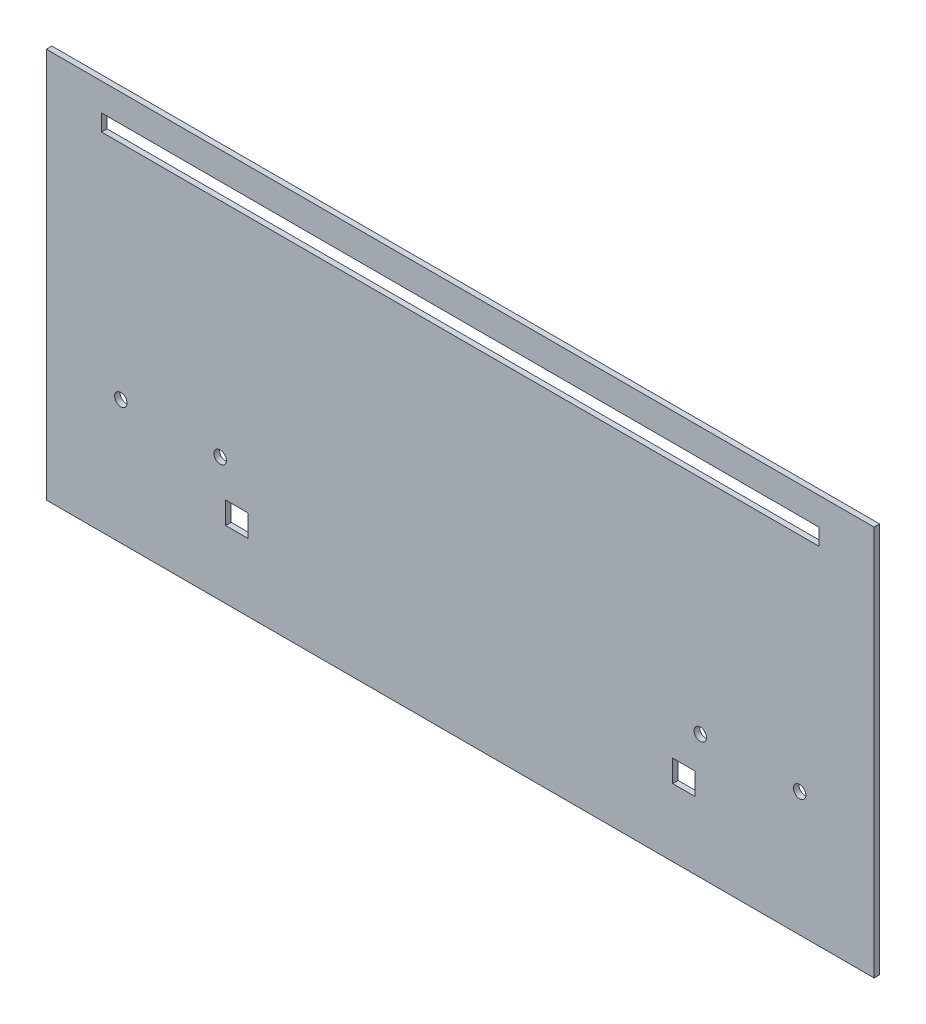
from build123d import *

# Parameters (mm, degrees)
SK_PANEL_W            = 300
SK_PANEL_H            = 141.5
EX_PANEL_DEPTH        = 2
SK_LIGHTSLOT_W        = 260
SK_LIGHTSLOT_H        = 6
CUT_LIGHTSLOT_DEPTH   = 2
SK_CLIFFBOLTS_R       = 2.25
CUT_CLIFFBOLTS_DEPTH  = 2
SK_CLIFFCABLES_W      = 8
SK_CLIFFCABLES_H      = 8
CUT_CLIFFCABLES_DEPTH = 2


with BuildPart() as part:
    # SK_Panel → EX_Panel (new body)
    with BuildSketch(Plane.XY):
        with Locations((0, 70.75)):
            Rectangle(SK_PANEL_W, SK_PANEL_H)
    extrude(amount=EX_PANEL_DEPTH)

    # SK_LightSlot → CUT_LightSlot (cut)
    with BuildSketch(Plane.XY):
        with Locations((0, 128.5)):
            Rectangle(SK_LIGHTSLOT_W, SK_LIGHTSLOT_H)
    extrude(amount=CUT_LIGHTSLOT_DEPTH, mode=Mode.SUBTRACT)

    # SK_CliffBolts → CUT_CliffBolts (cut)
    with BuildSketch(Plane.XY):
        with Locations((123, 45)):
            Circle(SK_CLIFFBOLTS_R)
        with Locations((87, 45)):
            Circle(SK_CLIFFBOLTS_R)
        with Locations((-123, 45)):
            Circle(SK_CLIFFBOLTS_R)
        with Locations((-87, 45)):
            Circle(SK_CLIFFBOLTS_R)
    extrude(amount=CUT_CLIFFBOLTS_DEPTH, mode=Mode.SUBTRACT)

    # SK_CliffCables → CUT_CliffCables (cut)
    with BuildSketch(Plane.XY):
        with Locations((81, 28.5)):
            Rectangle(SK_CLIFFCABLES_W, SK_CLIFFCABLES_H)
        with Locations((-81, 28.5)):
            Rectangle(SK_CLIFFCABLES_W, SK_CLIFFCABLES_H)
    extrude(amount=CUT_CLIFFCABLES_DEPTH, mode=Mode.SUBTRACT)


solid = part.part
